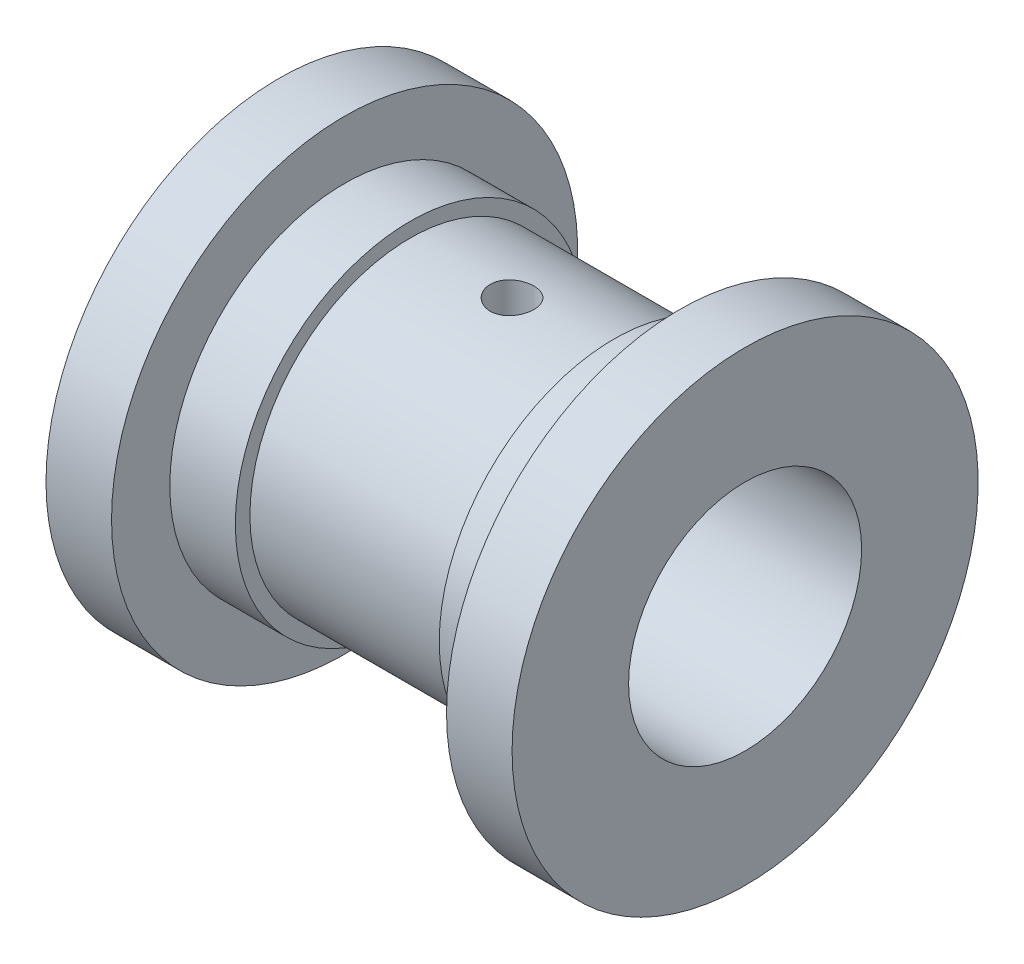
from build123d import *

# Parameters (mm, degrees)
SKETCH2_R           = 4
BOSS_EXTRUDE1_DEPTH = 30
SKETCH3_R           = 16
CUT_EXTRUDE1_DEPTH  = 64
SKETCH4_R           = 3
CUT_EXTRUDE2_DEPTH  = 77.75936425


with BuildPart() as part:
    # Sketch1 → Revolve1 (revolve)
    with BuildSketch(Plane.XY, mode=Mode.PRIVATE) as revolve1_sk:
        Polygon((14, 22), (-14, 22), (-14, 24), (-23, 24), (-23, 32), (-32, 32), (-32, 0), (32, 0), (32, 32), (23, 32), (23, 24), (14, 24), align=None)
    revolve(revolve1_sk.sketch.rotate(Axis((-34.429184549, 0, 0), (1, 0, 0)), 90), axis=Axis((-34.429184549, 0, 0), (1, 0, 0)))

    # Sketch2 → Boss-Extrude1 (add)
    with BuildSketch(Plane(origin=(0, 0, 0), x_dir=(1, 0, 0), z_dir=(0, 1, 0))):
        with Locations(Location((0, 0, 0), (0, 0, 270))):
            Circle(SKETCH2_R)
    extrude(amount=-BOSS_EXTRUDE1_DEPTH)

    # Sketch3 → Cut-Extrude1 (cut)
    with BuildSketch(Plane(origin=(32, 0, 0), x_dir=(0, 0, -1), z_dir=(1, 0, 0))):
        Circle(SKETCH3_R)
    extrude(amount=-CUT_EXTRUDE1_DEPTH, mode=Mode.SUBTRACT)

    # Sketch4 → Cut-Extrude2 (cut, through all)
    with BuildSketch(Plane.XZ.offset(30)):
        with Locations(Location((0, 0, 0), (0, 0, 270))):
            Circle(SKETCH4_R)
    extrude(amount=-CUT_EXTRUDE2_DEPTH, mode=Mode.SUBTRACT)


solid = part.part
